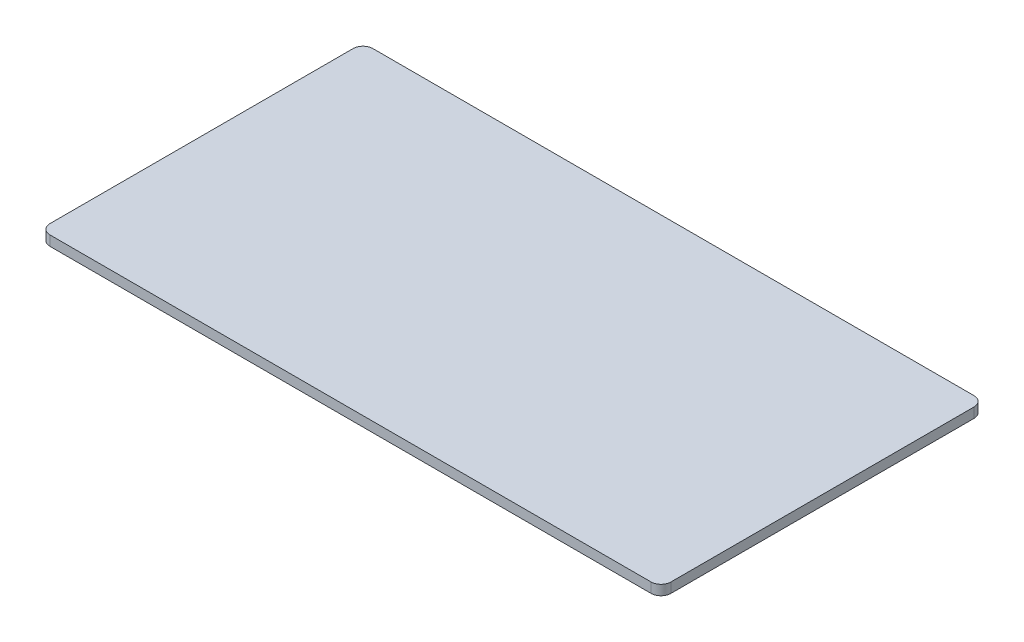
from build123d import *

# Parameters (mm, degrees)
SKETCH2_W           = 158.75
SKETCH2_H           = 82.55
BOSS_EXTRUDE1_DEPTH = 2.54
FILLET1_R           = 2.54


with BuildPart() as part:
    # Sketch2 → Boss-Extrude1 (new body)
    with BuildSketch(Plane(origin=(0, 0, 0), x_dir=(1, 0, 0), z_dir=(0, 1, 0))):
        with Locations((79.375, 41.275)):
            Rectangle(SKETCH2_W, SKETCH2_H)
    extrude(amount=BOSS_EXTRUDE1_DEPTH)

    # Fillet1
    fillet1_edges = [part.edges().sort_by_distance(p)[0] for p in [
        (0, 1.27, 0),
        (0, 1.27, -82.55),
        (158.75, 1.27, -82.55),
        (158.75, 1.27, 0),
    ]]
    fillet(fillet1_edges, radius=FILLET1_R)


solid = part.part
